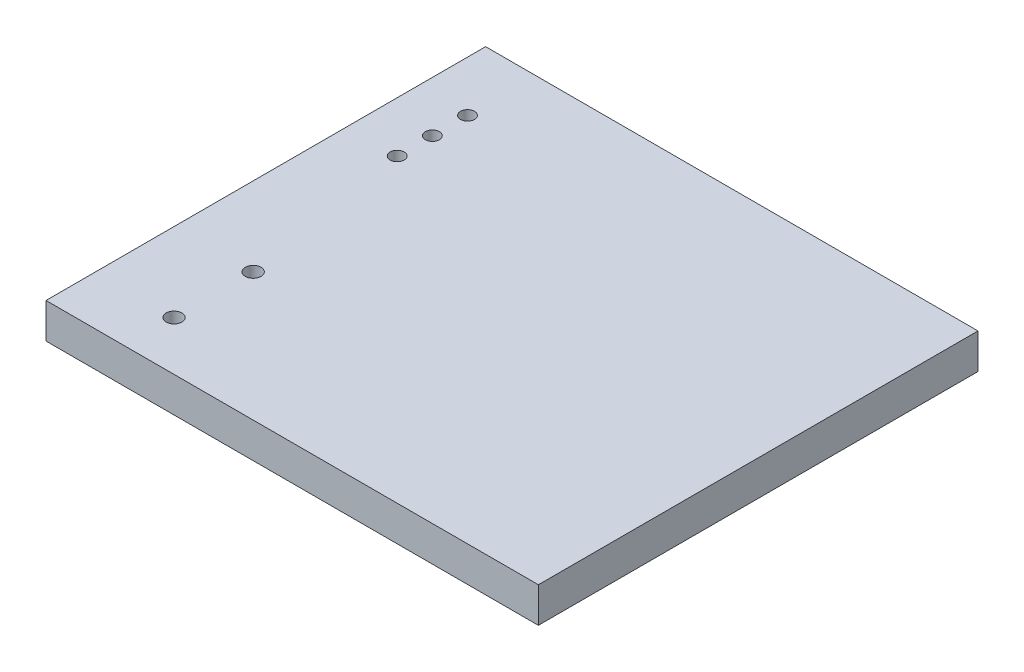
from build123d import *

# Parameters (mm, degrees)
SKETCH1_W           = 28
SKETCH1_H           = 25
BOSS_EXTRUDE1_DEPTH = 2
SKETCH2_R           = 0.45
CUT_EXTRUDE1_DEPTH  = 10
SKETCH3_R           = 0.4
CUT_EXTRUDE2_DEPTH  = 2.5


with BuildPart() as part:
    # Sketch1 → Boss-Extrude1 (new body)
    with BuildSketch(Plane(origin=(0, 0, 0), x_dir=(1, 0, 0), z_dir=(0, 1, 0))):
        Rectangle(SKETCH1_W, SKETCH1_H)
    extrude(amount=BOSS_EXTRUDE1_DEPTH)

    # Sketch2 → Cut-Extrude1 (cut)
    with BuildSketch(Plane(origin=(0, 0, 0), x_dir=(1, 0, 0), z_dir=(0, 1, 0))):
        with Locations(Location((-9.52, -5.2, 0), (0, 0, 90))):
            Circle(SKETCH2_R)
        with Locations(Location((-9.52, -9.7, 0), (0, 0, 90))):
            Circle(SKETCH2_R)
    extrude(amount=CUT_EXTRUDE1_DEPTH, mode=Mode.SUBTRACT)

    # Sketch3 → Cut-Extrude2 (cut)
    with BuildSketch(Plane(origin=(0, 0, 0), x_dir=(1, 0, 0), z_dir=(0, 1, 0))):
        with Locations(Location((-11.13, 6.6, 0), (0, 0, 90))):
            Circle(SKETCH3_R)
        with Locations(Location((-11.13, 8.6, 0), (0, 0, 90))):
            Circle(SKETCH3_R)
        with Locations(Location((-11.13, 4.6, 0), (0, 0, 90))):
            Circle(SKETCH3_R)
    extrude(amount=CUT_EXTRUDE2_DEPTH, mode=Mode.SUBTRACT)


solid = part.part
